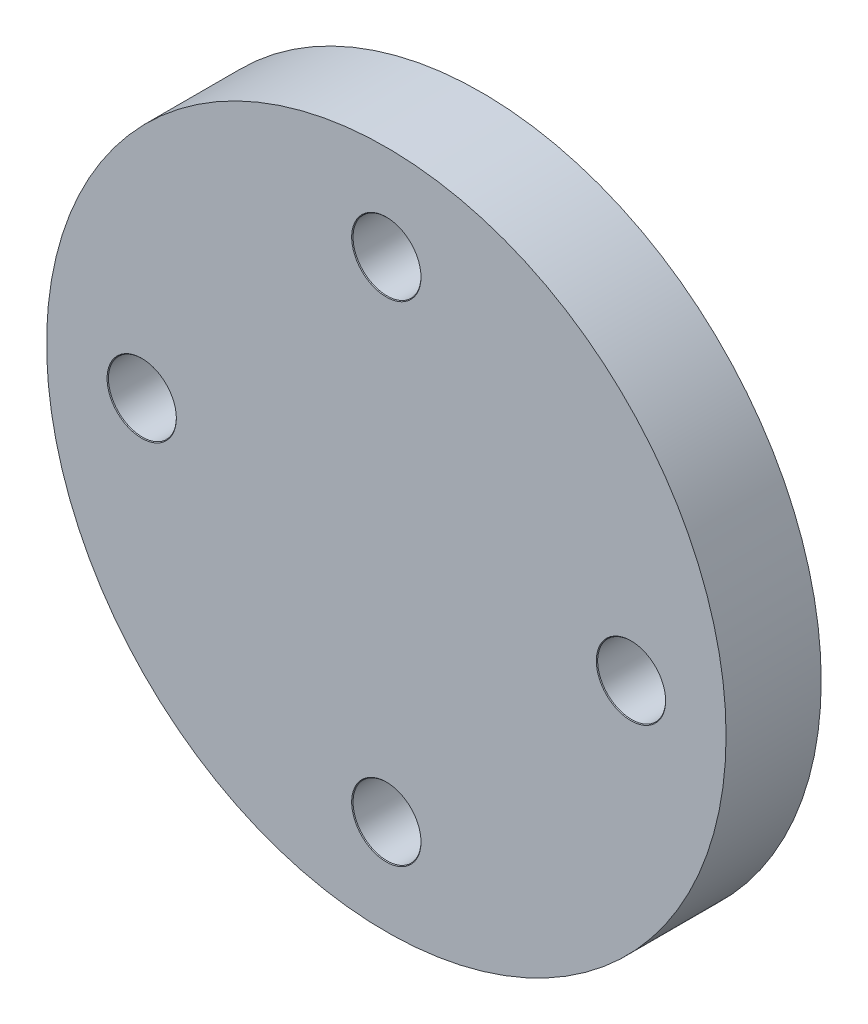
from build123d import *

# Parameters (mm, degrees)
SKETCH1_R           = 4
SKETCH1_R_2         = 2.5
BOSS_EXTRUDE1_DEPTH = 5
BOSS_EXTRUDE2_START = 3.5
SKETCH2_R           = 12.5
SKETCH2_R_2         = 2.5
BOSS_EXTRUDE2_DEPTH = 3.5
CIRPATTERN1_COUNT   = 4
CIRPATTERN2_COUNT   = 4
CHAMFER1_SIZE       = 0.5
SKETCH9_R           = 2.5
BOSS_EXTRUDE3_DEPTH = 2.9


with BuildPart() as part:
    # Sketch1 → Boss-Extrude1 (new body)
    with BuildSketch(Plane.XY):
        Circle(SKETCH1_R)
        Circle(SKETCH1_R_2, mode=Mode.SUBTRACT)
    extrude(amount=-BOSS_EXTRUDE1_DEPTH)

    # Sketch2 → Boss-Extrude2 (add)
    with BuildSketch(Plane.XY.offset(BOSS_EXTRUDE2_START)):
        Circle(SKETCH2_R)
        Circle(SKETCH2_R_2, mode=Mode.SUBTRACT)
    extrude(amount=-BOSS_EXTRUDE2_DEPTH)

    # Sketch6 → Tap Drill for M3 Tap1 (revolve, cut)
    with BuildSketch(Plane(origin=(4, 0, -2.5), x_dir=(0, 0, -1), z_dir=(0, 1, 0))):
        Polygon((0, 0), (0, 5.751075774), (1.25, 5), (1.25, 0.025), (1.275, 0), align=None)
    tap_drill_for_m3_tap1 = revolve(axis=Axis((10.35, 0, -2.5), (-1, 0, 0)), mode=Mode.SUBTRACT)

    # Sketch8 → Tap Drill for M3 Tap2 (revolve, cut)
    with BuildSketch(Plane(origin=(-9, 0, 3.5), x_dir=(0, -1, 0), z_dir=(1, 0, 0))):
        Polygon((0, 0), (0, 5.751075774), (1.25, 5), (1.25, 0.025), (1.275, 0), align=None)
    tap_drill_for_m3_tap2 = revolve(axis=Axis((-9, 0, 9.85), (0, 0, -1)), mode=Mode.SUBTRACT)

    # CirPattern1: Tap Drill for M3 Tap2 ×4 about axis
    cirpattern1_axis = Axis((0, 0, 0), (0, 0, 1))
    for i in range(1, CIRPATTERN1_COUNT):
        add(tap_drill_for_m3_tap2.rotate(cirpattern1_axis, i * 360 / CIRPATTERN1_COUNT), mode=Mode.SUBTRACT)

    # CirPattern2: Tap Drill for M3 Tap1 ×4 about axis
    cirpattern2_axis = Axis((0, 0, 0), (0, 0, 1))
    for i in range(1, CIRPATTERN2_COUNT):
        add(tap_drill_for_m3_tap1.rotate(cirpattern2_axis, i * 360 / CIRPATTERN2_COUNT), mode=Mode.SUBTRACT)

    # Chamfer1
    chamfer1_edges = [part.edges().sort_by_distance(p)[0] for p in [
        (-4, 0, -5),
    ]]
    chamfer(chamfer1_edges, length=CHAMFER1_SIZE)

    # Sketch9 → Boss-Extrude3 (add)
    with BuildSketch(Plane.XY.offset(3.5)):
        Circle(SKETCH9_R)
    extrude(amount=-BOSS_EXTRUDE3_DEPTH)


solid = part.part
